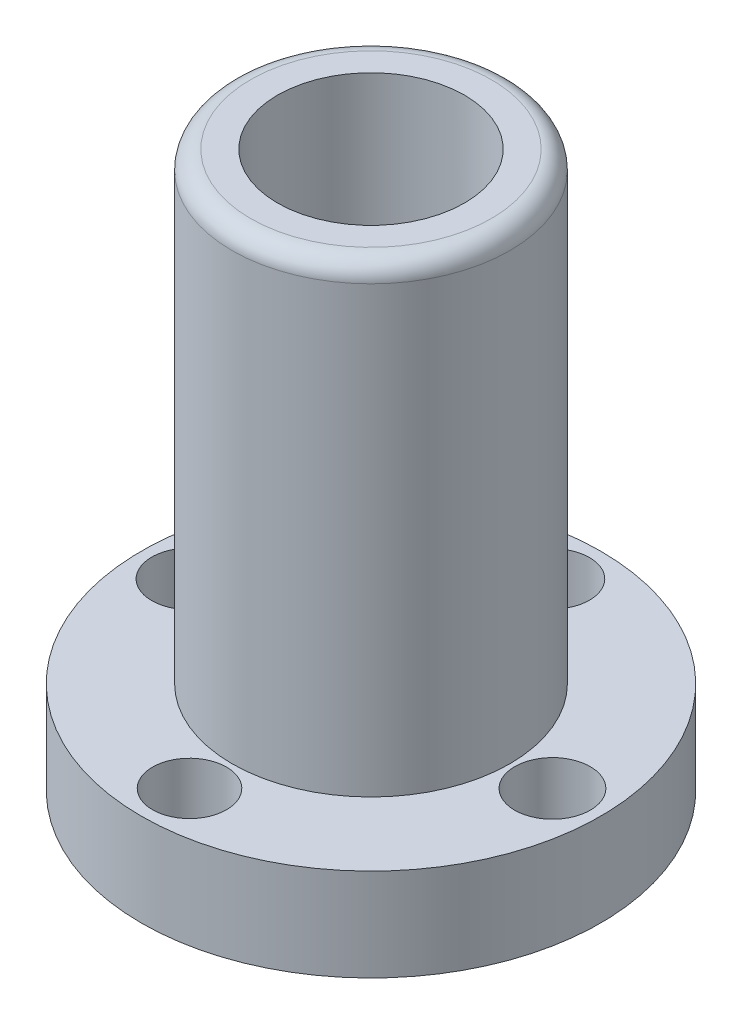
from build123d import *

# Parameters (mm, degrees)
SKETCH1_R                                  = 19.05
BOSS_EXTRUDE1_DEPTH                        = 63.5
SKETCH2_R                                  = 12.826740919
CUT_EXTRUDE1_DEPTH                         = 69.978656119
SKETCH3_R                                  = 6.33257482
CUT_EXTRUDE2_DEPTH                         = 69.978656119
FILLET1_R                                  = 2.54
SKETCH4_R                                  = 31.496
BOSS_EXTRUDE3_DEPTH                        = 12.7
SKETCH5_R                                  = 5.075123318
CUT_EXTRUDE3_DEPTH                         = 78.564463801
MIRROR1_AT_THE_SECOND_PLANE_COPY_1_SKETC_R = 5.075123318
MIRROR1_AT_THE_SECOND_PLANE_COPY_1_DEPTH   = 78.564463801
SKETCH6_R                                  = 5.182943359
CUT_EXTRUDE4_DEPTH                         = 78.564463801
MIRROR2_AT_THE_SECOND_PLANE_COPY_1_SKETC_R = 5.182943359
MIRROR2_AT_THE_SECOND_PLANE_COPY_1_DEPTH   = 78.564463801


with BuildPart() as part:
    # Sketch1 → Boss-Extrude1 (new body)
    with BuildSketch(Plane(origin=(0, 0, 0), x_dir=(1, 0, 0), z_dir=(0, 1, 0))):
        with Locations(Location((0, 0, 0), (0, 0, 270))):
            Circle(SKETCH1_R)
    extrude(amount=BOSS_EXTRUDE1_DEPTH)

    # Sketch2 → Cut-Extrude1 (cut, through all)
    with BuildSketch(Plane(origin=(0, 63.5, 0), x_dir=(1, 0, 0), z_dir=(0, 1, 0))):
        with Locations(Location((0, 0, 0), (0, 0, 270))):
            Circle(SKETCH2_R)
    extrude(amount=-CUT_EXTRUDE1_DEPTH, mode=Mode.SUBTRACT)

    # Sketch3 → Cut-Extrude2 (cut, through all)
    with BuildSketch(Plane.XY):
        with Locations((0, 31.75)):
            Circle(SKETCH3_R)
    extrude(amount=-CUT_EXTRUDE2_DEPTH, mode=Mode.SUBTRACT)

    # Fillet1
    fillet1_edges = [part.edges().sort_by_distance(p)[0] for p in [
        (0, 63.5, -19.05),
    ]]
    fillet(fillet1_edges, radius=FILLET1_R)

    # Sketch4 → Boss-Extrude3 (add)
    with BuildSketch(Plane.XZ):
        with Locations(Location((0, 0, 0), (0, 0, 270))):
            Circle(SKETCH4_R)
    extrude(amount=BOSS_EXTRUDE3_DEPTH)

    # Sketch5 → Cut-Extrude3 (cut, through all)
    with BuildSketch(Plane(origin=(0, 0, 0), x_dir=(1, 0, 0), z_dir=(0, 1, 0))):
        with Locations(Location((0, 24.892, 0), (0, 0, 270))):
            Circle(SKETCH5_R)
    cut_extrude3 = extrude(amount=-CUT_EXTRUDE3_DEPTH, mode=Mode.SUBTRACT)

    # Mirror1: Cut-Extrude3 across plane
    add(cut_extrude3.mirror(Plane(origin=(0, 0, 0), x_dir=(0, 0, 1), z_dir=(1, 0, 0))), mode=Mode.SUBTRACT)

    # Mirror1 at the second plane: Cut-Extrude3 across plane
    add(cut_extrude3.mirror(Plane.XY), mode=Mode.SUBTRACT)

    # Mirror1 at the second plane copy 1 sketc → Mirror1 at the second plane copy 1 (cut, through all)
    with BuildSketch(Plane(origin=(0, 0, 0), x_dir=(-1, 0, 0), z_dir=(0, 1, 0))):
        with Locations(Location((0, 24.892, 0), (0, 0, 270))):
            Circle(MIRROR1_AT_THE_SECOND_PLANE_COPY_1_SKETC_R)
    extrude(amount=-MIRROR1_AT_THE_SECOND_PLANE_COPY_1_DEPTH, mode=Mode.SUBTRACT)

    # Sketch6 → Cut-Extrude4 (cut, through all)
    with BuildSketch(Plane(origin=(0, 0, 0), x_dir=(1, 0, 0), z_dir=(0, 1, 0))):
        with Locations(Location((24.892, 0, 0), (0, 0, 270))):
            Circle(SKETCH6_R)
    cut_extrude4 = extrude(amount=-CUT_EXTRUDE4_DEPTH, mode=Mode.SUBTRACT)

    # Mirror2: Cut-Extrude4 across plane
    add(cut_extrude4.mirror(Plane.XY), mode=Mode.SUBTRACT)

    # Mirror2 at the second plane: Cut-Extrude4 across plane
    add(cut_extrude4.mirror(Plane(origin=(0, 0, 0), x_dir=(0, 0, 1), z_dir=(1, 0, 0))), mode=Mode.SUBTRACT)

    # Mirror2 at the second plane copy 1 sketc → Mirror2 at the second plane copy 1 (cut, through all)
    with BuildSketch(Plane(origin=(0, 0, 0), x_dir=(-1, 0, 0), z_dir=(0, 1, 0))):
        with Locations(Location((24.892, 0, 0), (0, 0, 270))):
            Circle(MIRROR2_AT_THE_SECOND_PLANE_COPY_1_SKETC_R)
    extrude(amount=-MIRROR2_AT_THE_SECOND_PLANE_COPY_1_DEPTH, mode=Mode.SUBTRACT)


solid = part.part
